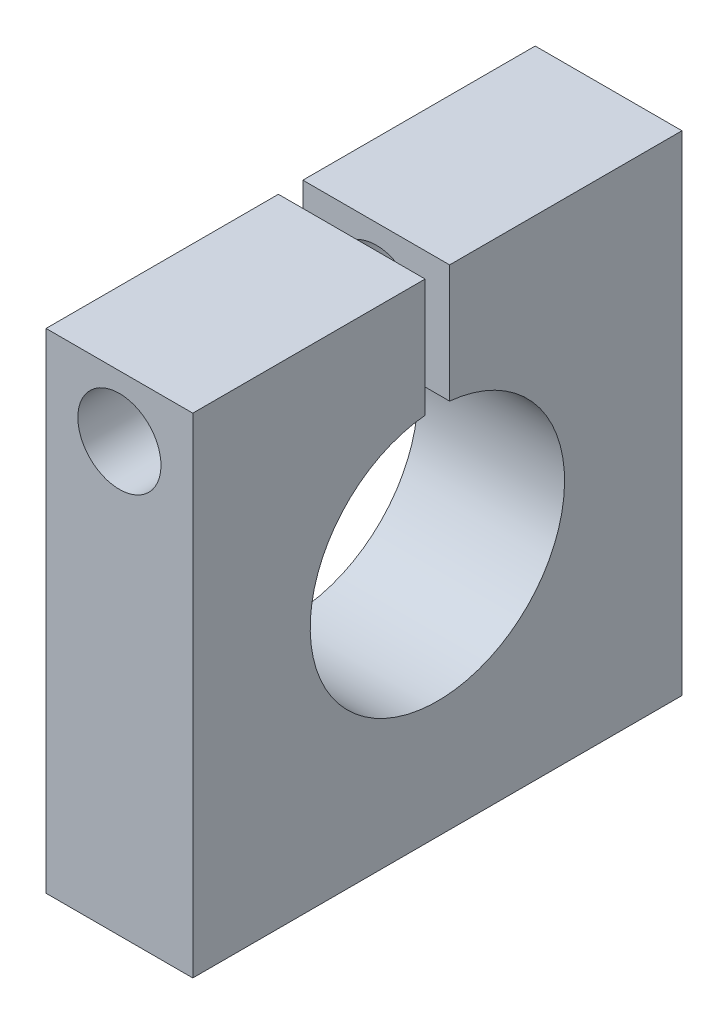
from build123d import *

# Parameters (mm, degrees)
BOSS_EXTRUDE1_DEPTH = 6
SKETCH2_R           = 1.7
CUT_EXTRUDE1_DEPTH  = 24.151673806


with BuildPart() as part:
    # Sketch1 → Boss-Extrude1 (new body)
    with BuildSketch(Plane(origin=(0, 0, 0), x_dir=(0, 0, -1), z_dir=(1, 0, 0))):
        with BuildLine():
            Line((-0.5, 5.175905718), (-0.5, 10))
            Line((-0.5, 10), (-10, 10))
            Line((-10, 10), (-10, -10))
            Line((-10, -10), (10, -10))
            Line((10, -10), (10, 10))
            Line((10, 10), (0.5, 10))
            Line((0.5, 10), (0.5, 5.175905718))
            ThreePointArc((0.5, 5.175905718), (3.849675311, 3.495711659), (5.2, 0))
            ThreePointArc((5.2, 0), (-3.495711659, -3.849675311), (-0.5, 5.175905718))
        make_face()
    extrude(amount=BOSS_EXTRUDE1_DEPTH)

    # Sketch2 → Cut-Extrude1 (cut, through all)
    with BuildSketch(Plane(origin=(0, 0, -10), x_dir=(-1, 0, 0), z_dir=(0, 0, -1))):
        with Locations(Location((-3, 7.5, 0), (0, 0, 90))):
            Circle(SKETCH2_R)
    extrude(amount=-CUT_EXTRUDE1_DEPTH, mode=Mode.SUBTRACT)


solid = part.part
